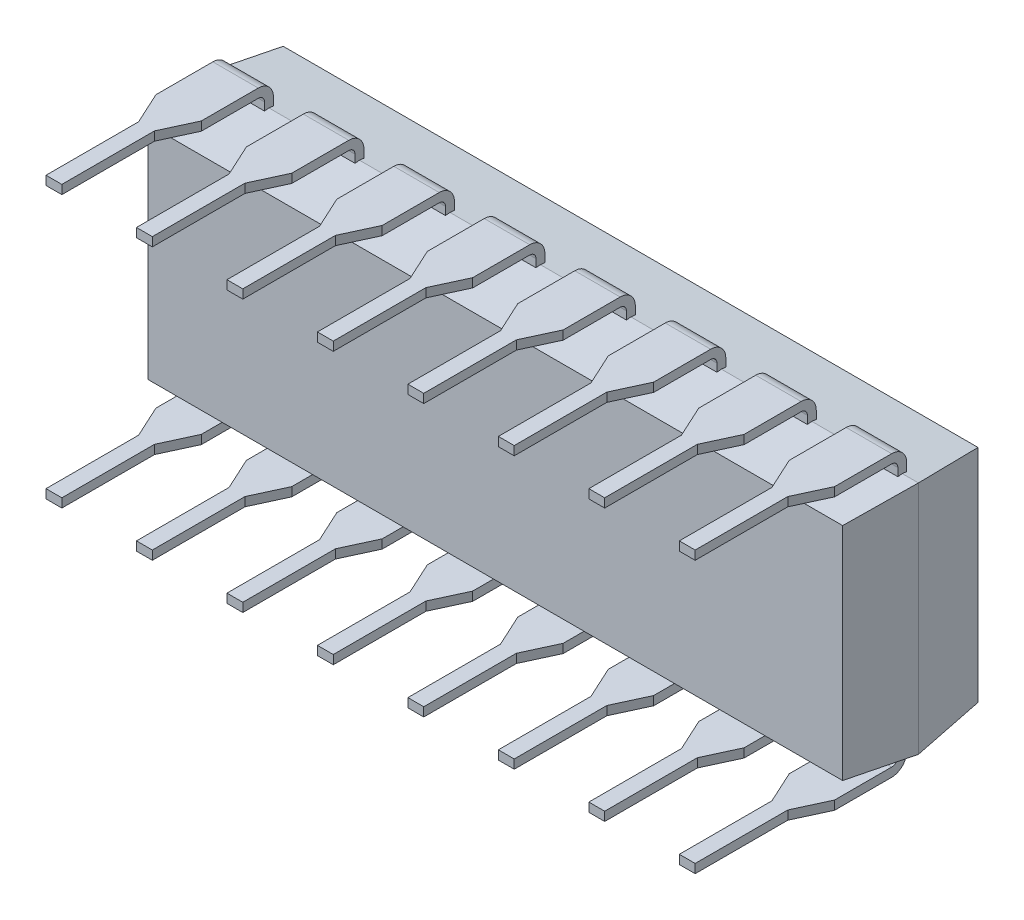
from build123d import *

# Parameters (mm, degrees)
RESSALTO_EXTRUS_O1_DEPTH        = 9.98
CORTE_EXTRUS_O2_DEPTH           = 3.55
ESBO_O8_R                       = 1
CORTE_EXTRUS_O5_DEPTH           = 0.5
ESBO_O6_W                       = 1.275
ESBO_O6_H                       = 0.25
RESSALTO_EXTRUS_O2_DEPTH        = 0.025
ESBO_O7_W                       = 1.275
ESBO_O7_H                       = 0.25
CORTE_EXTRUS_O6_START           = -0.25
CORTE_EXTRUS_O6_DEPTH           = 0.25
ESBO_O10_W                      = 0.445
ESBO_O10_H                      = 0.25
RESSALTO_EXTRUS_O3_DEPTH        = 2.6
PADR_O_LINEAR1_COUNT            = 8
PADR_O_LINEAR1_PITCH            = 2.54
PADR_O_LINEAR1_COPY_1_SKETCH_W  = 1.275
PADR_O_LINEAR1_COPY_1_SKETCH_H  = 0.25
PADR_O_LINEAR1_COPY_1_DEPTH     = 0.025
PADR_O_LINEAR1_COPY_2_SKETCH_W  = 1.275
PADR_O_LINEAR1_COPY_2_SKETCH_H  = 0.25
PADR_O_LINEAR1_COPY_2_DEPTH     = 0.025
PADR_O_LINEAR1_COPY_3_SKETCH_W  = 1.275
PADR_O_LINEAR1_COPY_3_SKETCH_H  = 0.25
PADR_O_LINEAR1_COPY_3_DEPTH     = 0.025
PADR_O_LINEAR1_COPY_4_SKETCH_W  = 1.275
PADR_O_LINEAR1_COPY_4_SKETCH_H  = 0.25
PADR_O_LINEAR1_COPY_4_DEPTH     = 0.025
PADR_O_LINEAR1_COPY_5_SKETCH_W  = 1.275
PADR_O_LINEAR1_COPY_5_SKETCH_H  = 0.25
PADR_O_LINEAR1_COPY_5_DEPTH     = 0.025
PADR_O_LINEAR1_COPY_6_SKETCH_W  = 1.275
PADR_O_LINEAR1_COPY_6_SKETCH_H  = 0.25
PADR_O_LINEAR1_COPY_6_DEPTH     = 0.025
PADR_O_LINEAR1_COPY_7_SKETCH_W  = 1.275
PADR_O_LINEAR1_COPY_7_SKETCH_H  = 0.25
PADR_O_LINEAR1_COPY_7_DEPTH     = 0.025
PADR_O_LINEAR1_COPY_8_SKETCH_W  = 1.275
PADR_O_LINEAR1_COPY_8_SKETCH_H  = 0.25
PADR_O_LINEAR1_COPY_9_SKETCH_W  = 1.275
PADR_O_LINEAR1_COPY_9_SKETCH_H  = 0.25
PADR_O_LINEAR1_COPY_10_SKETCH_W = 1.275
PADR_O_LINEAR1_COPY_10_SKETCH_H = 0.25
PADR_O_LINEAR1_COPY_11_SKETCH_W = 1.275
PADR_O_LINEAR1_COPY_11_SKETCH_H = 0.25
PADR_O_LINEAR1_COPY_12_SKETCH_W = 1.275
PADR_O_LINEAR1_COPY_12_SKETCH_H = 0.25
PADR_O_LINEAR1_COPY_13_SKETCH_W = 1.275
PADR_O_LINEAR1_COPY_13_SKETCH_H = 0.25
PADR_O_LINEAR1_COPY_14_SKETCH_W = 1.275
PADR_O_LINEAR1_COPY_14_SKETCH_H = 0.25
PADR_O_START                    = -0.25
PADR_O_LINEAR1_COPY_15_DEPTH    = 0.25
PADR_O_LINEAR1_COPY_16_DEPTH    = 0.25
PADR_O_LINEAR1_COPY_17_DEPTH    = 0.25
PADR_O_LINEAR1_COPY_18_DEPTH    = 0.25
PADR_O_LINEAR1_COPY_19_DEPTH    = 0.25
PADR_O_LINEAR1_COPY_20_DEPTH    = 0.25
PADR_O_LINEAR1_COPY_21_DEPTH    = 0.25
PADR_O_LINEAR1_COPY_22_SKETCH_W = 0.445
PADR_O_LINEAR1_COPY_22_SKETCH_H = 0.25
PADR_O_LINEAR1_COPY_22_DEPTH    = 2.6
PADR_O_LINEAR1_COPY_23_SKETCH_W = 0.445
PADR_O_LINEAR1_COPY_23_SKETCH_H = 0.25
PADR_O_LINEAR1_COPY_23_DEPTH    = 2.6
PADR_O_LINEAR1_COPY_24_SKETCH_W = 0.445
PADR_O_LINEAR1_COPY_24_SKETCH_H = 0.25
PADR_O_LINEAR1_COPY_24_DEPTH    = 2.6
PADR_O_LINEAR1_COPY_25_SKETCH_W = 0.445
PADR_O_LINEAR1_COPY_25_SKETCH_H = 0.25
PADR_O_LINEAR1_COPY_25_DEPTH    = 2.6
PADR_O_LINEAR1_COPY_26_SKETCH_W = 0.445
PADR_O_LINEAR1_COPY_26_SKETCH_H = 0.25
PADR_O_LINEAR1_COPY_26_DEPTH    = 2.6
PADR_O_LINEAR1_COPY_27_SKETCH_W = 0.445
PADR_O_LINEAR1_COPY_27_SKETCH_H = 0.25
PADR_O_LINEAR1_COPY_27_DEPTH    = 2.6
PADR_O_LINEAR1_COPY_28_SKETCH_W = 0.445
PADR_O_LINEAR1_COPY_28_SKETCH_H = 0.25
PADR_O_LINEAR1_COPY_28_DEPTH    = 2.6


with BuildPart() as part:
    # Esboço1 → Ressalto-extrusão1 (new, symmetric)
    with BuildSketch(Plane(origin=(0, 0, 0), x_dir=(0, 0, -1), z_dir=(1, 0, 0))):
        Polygon((0.9, 3.1), (0.9, -3.1), (2.8, -3.3), (4.7, -3.1), (4.7, 3.1), (2.8, 3.3), align=None)
    extrude(amount=RESSALTO_EXTRUS_O1_DEPTH, both=True)

    # Esboço3 → Corte-extrusão2 (cut, symmetric)
    with BuildSketch(Plane(origin=(0, 0, 0), x_dir=(1, 0, 0), z_dir=(0, 1, 0))):
        Polygon((-9.98, 2.8), (-9.749897634, 4.726835982), (-10.916348907, 4.726835982), (-10.916348907, 0.873164018), (-9.749897634, 0.873164018), align=None)
    corte_extrus_o2 = extrude(amount=CORTE_EXTRUS_O2_DEPTH, both=True, mode=Mode.SUBTRACT)

    # Espelhar1: Corte-extrusão2 across plane
    add(corte_extrus_o2.mirror(Plane(origin=(0, 0, 0), x_dir=(0, 0, 1), z_dir=(1, 0, 0))), mode=Mode.SUBTRACT)

    # Esboço8 → Corte-extrusão5 (cut)
    with BuildSketch(Plane(origin=(0, 0, -4.7), x_dir=(-1, 0, 0), z_dir=(0, 0, -1))):
        with Locations((9.753102382, 0)):
            Circle(ESBO_O8_R)
    extrude(amount=-CORTE_EXTRUS_O5_DEPTH, mode=Mode.SUBTRACT)

    # Esboço6 → Ressalto-extrusão2 (add, symmetric)
    with BuildSketch(Plane(origin=(0, 3.3, 0), x_dir=(1, 0, 0), z_dir=(0, 1, 0))):
        with Locations((-8.89, 2.8)):
            Rectangle(ESBO_O6_W, ESBO_O6_H)
    ressalto_extrus_o2 = extrude(amount=RESSALTO_EXTRUS_O2_DEPTH, both=True)

    # Varredura1: sweep along a curve in space
    with BuildLine() as varredura1_path:
        Line((-8.89, 3.325, -2.8), (-8.89, 3.51, -2.8))
        ThreePointArc((-8.89, 3.51, -2.8), (-8.89, 3.722132034, -2.712132034), (-8.89, 3.81, -2.5))
        Line((-8.89, 3.81, -2.5), (-8.89, 3.81, 0))
    # Esboço7 → Varredura1 (sweep)
    with BuildSketch(Plane(origin=(0, 3.325, 0), x_dir=(1, 0, 0), z_dir=(0, 1, 0))):
        with Locations((-8.89, 2.8)):
            Rectangle(ESBO_O7_W, ESBO_O7_H)
    varredura1 = sweep(path=varredura1_path.line)

    # Esboço9 → Corte-extrusão6 (cut)
    with BuildSketch(Plane(origin=(0, 3.935, 0), x_dir=(1, 0, 0), z_dir=(0, 1, 0)).offset(CORTE_EXTRUS_O6_START)):
        Polygon((-9.1125, 0), (-9.5275, 0.9), (-9.5275, -0.2), (-8.2525, -0.2), (-8.2525, 0.9), (-8.6675, 0), align=None)
    corte_extrus_o6 = extrude(amount=CORTE_EXTRUS_O6_DEPTH, mode=Mode.SUBTRACT)

    # Esboço10 → Ressalto-extrusão3 (add)
    with BuildSketch(Plane.XY):
        with Locations((-8.89, 3.81)):
            Rectangle(ESBO_O10_W, ESBO_O10_H)
    ressalto_extrus_o3 = extrude(amount=RESSALTO_EXTRUS_O3_DEPTH)

    # Espelhar2: Ressalto-extrusão2, Varredura1, Corte-extrusão6, Ressalto-extrusão3 across plane
    add(ressalto_extrus_o2.mirror(Plane.ZX))
    add(varredura1.mirror(Plane.ZX))
    add(corte_extrus_o6.mirror(Plane.ZX), mode=Mode.SUBTRACT)
    add(ressalto_extrus_o3.mirror(Plane.ZX))

    # Padrão linear1: Ressalto-extrusão2, Varredura1, Corte-extrusão6, Ressalto-extrusão3 ×8
    with Locations(*[(i * PADR_O_LINEAR1_PITCH, 0, 0) for i in range(1, PADR_O_LINEAR1_COUNT)]):
        add(ressalto_extrus_o2)
        add(varredura1)
        add(corte_extrus_o6, mode=Mode.SUBTRACT)
        add(ressalto_extrus_o3)

    # Padrão linear1 copy 1 sketch → Padrão linear1 copy 1 (add, symmetric)
    with BuildSketch(Plane(origin=(2.54, -3.3, 0), x_dir=(1, 0, 0), z_dir=(0, -1, 0))):
        with Locations((-8.89, -2.8)):
            Rectangle(PADR_O_LINEAR1_COPY_1_SKETCH_W, PADR_O_LINEAR1_COPY_1_SKETCH_H)
    extrude(amount=PADR_O_LINEAR1_COPY_1_DEPTH, both=True)

    # Padrão linear1 copy 2 sketch → Padrão linear1 copy 2 (add, symmetric)
    with BuildSketch(Plane(origin=(5.08, -3.3, 0), x_dir=(1, 0, 0), z_dir=(0, -1, 0))):
        with Locations((-8.89, -2.8)):
            Rectangle(PADR_O_LINEAR1_COPY_2_SKETCH_W, PADR_O_LINEAR1_COPY_2_SKETCH_H)
    extrude(amount=PADR_O_LINEAR1_COPY_2_DEPTH, both=True)

    # Padrão linear1 copy 3 sketch → Padrão linear1 copy 3 (add, symmetric)
    with BuildSketch(Plane(origin=(7.62, -3.3, 0), x_dir=(1, 0, 0), z_dir=(0, -1, 0))):
        with Locations((-8.89, -2.8)):
            Rectangle(PADR_O_LINEAR1_COPY_3_SKETCH_W, PADR_O_LINEAR1_COPY_3_SKETCH_H)
    extrude(amount=PADR_O_LINEAR1_COPY_3_DEPTH, both=True)

    # Padrão linear1 copy 4 sketch → Padrão linear1 copy 4 (add, symmetric)
    with BuildSketch(Plane(origin=(10.16, -3.3, 0), x_dir=(1, 0, 0), z_dir=(0, -1, 0))):
        with Locations((-8.89, -2.8)):
            Rectangle(PADR_O_LINEAR1_COPY_4_SKETCH_W, PADR_O_LINEAR1_COPY_4_SKETCH_H)
    extrude(amount=PADR_O_LINEAR1_COPY_4_DEPTH, both=True)

    # Padrão linear1 copy 5 sketch → Padrão linear1 copy 5 (add, symmetric)
    with BuildSketch(Plane(origin=(12.7, -3.3, 0), x_dir=(1, 0, 0), z_dir=(0, -1, 0))):
        with Locations((-8.89, -2.8)):
            Rectangle(PADR_O_LINEAR1_COPY_5_SKETCH_W, PADR_O_LINEAR1_COPY_5_SKETCH_H)
    extrude(amount=PADR_O_LINEAR1_COPY_5_DEPTH, both=True)

    # Padrão linear1 copy 6 sketch → Padrão linear1 copy 6 (add, symmetric)
    with BuildSketch(Plane(origin=(15.24, -3.3, 0), x_dir=(1, 0, 0), z_dir=(0, -1, 0))):
        with Locations((-8.89, -2.8)):
            Rectangle(PADR_O_LINEAR1_COPY_6_SKETCH_W, PADR_O_LINEAR1_COPY_6_SKETCH_H)
    extrude(amount=PADR_O_LINEAR1_COPY_6_DEPTH, both=True)

    # Padrão linear1 copy 7 sketch → Padrão linear1 copy 7 (add, symmetric)
    with BuildSketch(Plane(origin=(17.78, -3.3, 0), x_dir=(1, 0, 0), z_dir=(0, -1, 0))):
        with Locations((-8.89, -2.8)):
            Rectangle(PADR_O_LINEAR1_COPY_7_SKETCH_W, PADR_O_LINEAR1_COPY_7_SKETCH_H)
    extrude(amount=PADR_O_LINEAR1_COPY_7_DEPTH, both=True)

    # Padrão linear1 copy 8: sweep along a curve in space
    with BuildLine() as padr_o_linear1_copy_8_path:
        Line((-6.35, -3.325, -2.8), (-6.35, -3.51, -2.8))
        ThreePointArc((-6.35, -3.51, -2.8), (-6.35, -3.722132034, -2.712132034), (-6.35, -3.81, -2.5))
        Line((-6.35, -3.81, -2.5), (-6.35, -3.81, 0))
    # Padrão linear1 copy 8 sketch → Padrão linear1 copy 8 (sweep)
    with BuildSketch(Plane(origin=(2.54, -3.325, 0), x_dir=(1, 0, 0), z_dir=(0, -1, 0))):
        with Locations((-8.89, -2.8)):
            Rectangle(PADR_O_LINEAR1_COPY_8_SKETCH_W, PADR_O_LINEAR1_COPY_8_SKETCH_H)
    sweep(path=padr_o_linear1_copy_8_path.line)

    # Padrão linear1 copy 9: sweep along a curve in space
    with BuildLine() as padr_o_linear1_copy_9_path:
        Line((-3.81, -3.325, -2.8), (-3.81, -3.51, -2.8))
        ThreePointArc((-3.81, -3.51, -2.8), (-3.81, -3.722132034, -2.712132034), (-3.81, -3.81, -2.5))
        Line((-3.81, -3.81, -2.5), (-3.81, -3.81, 0))
    # Padrão linear1 copy 9 sketch → Padrão linear1 copy 9 (sweep)
    with BuildSketch(Plane(origin=(5.08, -3.325, 0), x_dir=(1, 0, 0), z_dir=(0, -1, 0))):
        with Locations((-8.89, -2.8)):
            Rectangle(PADR_O_LINEAR1_COPY_9_SKETCH_W, PADR_O_LINEAR1_COPY_9_SKETCH_H)
    sweep(path=padr_o_linear1_copy_9_path.line)

    # Padrão linear1 copy 10: sweep along a curve in space
    with BuildLine() as padr_o_linear1_copy_10_path:
        Line((-1.27, -3.325, -2.8), (-1.27, -3.51, -2.8))
        ThreePointArc((-1.27, -3.51, -2.8), (-1.27, -3.722132034, -2.712132034), (-1.27, -3.81, -2.5))
        Line((-1.27, -3.81, -2.5), (-1.27, -3.81, 0))
    # Padrão linear1 copy 10 sketch → Padrão linear1 copy 10 (sweep)
    with BuildSketch(Plane(origin=(7.62, -3.325, 0), x_dir=(1, 0, 0), z_dir=(0, -1, 0))):
        with Locations((-8.89, -2.8)):
            Rectangle(PADR_O_LINEAR1_COPY_10_SKETCH_W, PADR_O_LINEAR1_COPY_10_SKETCH_H)
    sweep(path=padr_o_linear1_copy_10_path.line)

    # Padrão linear1 copy 11: sweep along a curve in space
    with BuildLine() as padr_o_linear1_copy_11_path:
        Line((1.27, -3.325, -2.8), (1.27, -3.51, -2.8))
        ThreePointArc((1.27, -3.51, -2.8), (1.27, -3.722132034, -2.712132034), (1.27, -3.81, -2.5))
        Line((1.27, -3.81, -2.5), (1.27, -3.81, 0))
    # Padrão linear1 copy 11 sketch → Padrão linear1 copy 11 (sweep)
    with BuildSketch(Plane(origin=(10.16, -3.325, 0), x_dir=(1, 0, 0), z_dir=(0, -1, 0))):
        with Locations((-8.89, -2.8)):
            Rectangle(PADR_O_LINEAR1_COPY_11_SKETCH_W, PADR_O_LINEAR1_COPY_11_SKETCH_H)
    sweep(path=padr_o_linear1_copy_11_path.line)

    # Padrão linear1 copy 12: sweep along a curve in space
    with BuildLine() as padr_o_linear1_copy_12_path:
        Line((3.81, -3.325, -2.8), (3.81, -3.51, -2.8))
        ThreePointArc((3.81, -3.51, -2.8), (3.81, -3.722132034, -2.712132034), (3.81, -3.81, -2.5))
        Line((3.81, -3.81, -2.5), (3.81, -3.81, 0))
    # Padrão linear1 copy 12 sketch → Padrão linear1 copy 12 (sweep)
    with BuildSketch(Plane(origin=(12.7, -3.325, 0), x_dir=(1, 0, 0), z_dir=(0, -1, 0))):
        with Locations((-8.89, -2.8)):
            Rectangle(PADR_O_LINEAR1_COPY_12_SKETCH_W, PADR_O_LINEAR1_COPY_12_SKETCH_H)
    sweep(path=padr_o_linear1_copy_12_path.line)

    # Padrão linear1 copy 13: sweep along a curve in space
    with BuildLine() as padr_o_linear1_copy_13_path:
        Line((6.35, -3.325, -2.8), (6.35, -3.51, -2.8))
        ThreePointArc((6.35, -3.51, -2.8), (6.35, -3.722132034, -2.712132034), (6.35, -3.81, -2.5))
        Line((6.35, -3.81, -2.5), (6.35, -3.81, 0))
    # Padrão linear1 copy 13 sketch → Padrão linear1 copy 13 (sweep)
    with BuildSketch(Plane(origin=(15.24, -3.325, 0), x_dir=(1, 0, 0), z_dir=(0, -1, 0))):
        with Locations((-8.89, -2.8)):
            Rectangle(PADR_O_LINEAR1_COPY_13_SKETCH_W, PADR_O_LINEAR1_COPY_13_SKETCH_H)
    sweep(path=padr_o_linear1_copy_13_path.line)

    # Padrão linear1 copy 14: sweep along a curve in space
    with BuildLine() as padr_o_linear1_copy_14_path:
        Line((8.89, -3.325, -2.8), (8.89, -3.51, -2.8))
        ThreePointArc((8.89, -3.51, -2.8), (8.89, -3.722132034, -2.712132034), (8.89, -3.81, -2.5))
        Line((8.89, -3.81, -2.5), (8.89, -3.81, 0))
    # Padrão linear1 copy 14 sketch → Padrão linear1 copy 14 (sweep)
    with BuildSketch(Plane(origin=(17.78, -3.325, 0), x_dir=(1, 0, 0), z_dir=(0, -1, 0))):
        with Locations((-8.89, -2.8)):
            Rectangle(PADR_O_LINEAR1_COPY_14_SKETCH_W, PADR_O_LINEAR1_COPY_14_SKETCH_H)
    sweep(path=padr_o_linear1_copy_14_path.line)

    # Padrão linear1 copy 15 sketch → Padrão linear1 copy 15 (cut)
    with BuildSketch(Plane(origin=(2.54, -3.935, 0), x_dir=(1, 0, 0), z_dir=(0, -1, 0)).offset(PADR_O_START)):
        Polygon((-9.1125, 0), (-9.5275, -0.9), (-9.5275, 0.2), (-8.2525, 0.2), (-8.2525, -0.9), (-8.6675, 0), align=None)
    extrude(amount=PADR_O_LINEAR1_COPY_15_DEPTH, mode=Mode.SUBTRACT)

    # Padrão linear1 copy 16 sketch → Padrão linear1 copy 16 (cut)
    with BuildSketch(Plane(origin=(5.08, -3.935, 0), x_dir=(1, 0, 0), z_dir=(0, -1, 0)).offset(PADR_O_START)):
        Polygon((-9.1125, 0), (-9.5275, -0.9), (-9.5275, 0.2), (-8.2525, 0.2), (-8.2525, -0.9), (-8.6675, 0), align=None)
    extrude(amount=PADR_O_LINEAR1_COPY_16_DEPTH, mode=Mode.SUBTRACT)

    # Padrão linear1 copy 17 sketch → Padrão linear1 copy 17 (cut)
    with BuildSketch(Plane(origin=(7.62, -3.935, 0), x_dir=(1, 0, 0), z_dir=(0, -1, 0)).offset(PADR_O_START)):
        Polygon((-9.1125, 0), (-9.5275, -0.9), (-9.5275, 0.2), (-8.2525, 0.2), (-8.2525, -0.9), (-8.6675, 0), align=None)
    extrude(amount=PADR_O_LINEAR1_COPY_17_DEPTH, mode=Mode.SUBTRACT)

    # Padrão linear1 copy 18 sketch → Padrão linear1 copy 18 (cut)
    with BuildSketch(Plane(origin=(10.16, -3.935, 0), x_dir=(1, 0, 0), z_dir=(0, -1, 0)).offset(PADR_O_START)):
        Polygon((-9.1125, 0), (-9.5275, -0.9), (-9.5275, 0.2), (-8.2525, 0.2), (-8.2525, -0.9), (-8.6675, 0), align=None)
    extrude(amount=PADR_O_LINEAR1_COPY_18_DEPTH, mode=Mode.SUBTRACT)

    # Padrão linear1 copy 19 sketch → Padrão linear1 copy 19 (cut)
    with BuildSketch(Plane(origin=(12.7, -3.935, 0), x_dir=(1, 0, 0), z_dir=(0, -1, 0)).offset(PADR_O_START)):
        Polygon((-9.1125, 0), (-9.5275, -0.9), (-9.5275, 0.2), (-8.2525, 0.2), (-8.2525, -0.9), (-8.6675, 0), align=None)
    extrude(amount=PADR_O_LINEAR1_COPY_19_DEPTH, mode=Mode.SUBTRACT)

    # Padrão linear1 copy 20 sketch → Padrão linear1 copy 20 (cut)
    with BuildSketch(Plane(origin=(15.24, -3.935, 0), x_dir=(1, 0, 0), z_dir=(0, -1, 0)).offset(PADR_O_START)):
        Polygon((-9.1125, 0), (-9.5275, -0.9), (-9.5275, 0.2), (-8.2525, 0.2), (-8.2525, -0.9), (-8.6675, 0), align=None)
    extrude(amount=PADR_O_LINEAR1_COPY_20_DEPTH, mode=Mode.SUBTRACT)

    # Padrão linear1 copy 21 sketch → Padrão linear1 copy 21 (cut)
    with BuildSketch(Plane(origin=(17.78, -3.935, 0), x_dir=(1, 0, 0), z_dir=(0, -1, 0)).offset(PADR_O_START)):
        Polygon((-9.1125, 0), (-9.5275, -0.9), (-9.5275, 0.2), (-8.2525, 0.2), (-8.2525, -0.9), (-8.6675, 0), align=None)
    extrude(amount=PADR_O_LINEAR1_COPY_21_DEPTH, mode=Mode.SUBTRACT)

    # Padrão linear1 copy 22 sketch → Padrão linear1 copy 22 (add)
    with BuildSketch(Plane(origin=(2.54, 0, 0), x_dir=(1, 0, 0), z_dir=(0, 0, 1))):
        with Locations((-8.89, -3.81)):
            Rectangle(PADR_O_LINEAR1_COPY_22_SKETCH_W, PADR_O_LINEAR1_COPY_22_SKETCH_H)
    extrude(amount=PADR_O_LINEAR1_COPY_22_DEPTH)

    # Padrão linear1 copy 23 sketch → Padrão linear1 copy 23 (add)
    with BuildSketch(Plane(origin=(5.08, 0, 0), x_dir=(1, 0, 0), z_dir=(0, 0, 1))):
        with Locations((-8.89, -3.81)):
            Rectangle(PADR_O_LINEAR1_COPY_23_SKETCH_W, PADR_O_LINEAR1_COPY_23_SKETCH_H)
    extrude(amount=PADR_O_LINEAR1_COPY_23_DEPTH)

    # Padrão linear1 copy 24 sketch → Padrão linear1 copy 24 (add)
    with BuildSketch(Plane(origin=(7.62, 0, 0), x_dir=(1, 0, 0), z_dir=(0, 0, 1))):
        with Locations((-8.89, -3.81)):
            Rectangle(PADR_O_LINEAR1_COPY_24_SKETCH_W, PADR_O_LINEAR1_COPY_24_SKETCH_H)
    extrude(amount=PADR_O_LINEAR1_COPY_24_DEPTH)

    # Padrão linear1 copy 25 sketch → Padrão linear1 copy 25 (add)
    with BuildSketch(Plane(origin=(10.16, 0, 0), x_dir=(1, 0, 0), z_dir=(0, 0, 1))):
        with Locations((-8.89, -3.81)):
            Rectangle(PADR_O_LINEAR1_COPY_25_SKETCH_W, PADR_O_LINEAR1_COPY_25_SKETCH_H)
    extrude(amount=PADR_O_LINEAR1_COPY_25_DEPTH)

    # Padrão linear1 copy 26 sketch → Padrão linear1 copy 26 (add)
    with BuildSketch(Plane(origin=(12.7, 0, 0), x_dir=(1, 0, 0), z_dir=(0, 0, 1))):
        with Locations((-8.89, -3.81)):
            Rectangle(PADR_O_LINEAR1_COPY_26_SKETCH_W, PADR_O_LINEAR1_COPY_26_SKETCH_H)
    extrude(amount=PADR_O_LINEAR1_COPY_26_DEPTH)

    # Padrão linear1 copy 27 sketch → Padrão linear1 copy 27 (add)
    with BuildSketch(Plane(origin=(15.24, 0, 0), x_dir=(1, 0, 0), z_dir=(0, 0, 1))):
        with Locations((-8.89, -3.81)):
            Rectangle(PADR_O_LINEAR1_COPY_27_SKETCH_W, PADR_O_LINEAR1_COPY_27_SKETCH_H)
    extrude(amount=PADR_O_LINEAR1_COPY_27_DEPTH)

    # Padrão linear1 copy 28 sketch → Padrão linear1 copy 28 (add)
    with BuildSketch(Plane(origin=(17.78, 0, 0), x_dir=(1, 0, 0), z_dir=(0, 0, 1))):
        with Locations((-8.89, -3.81)):
            Rectangle(PADR_O_LINEAR1_COPY_28_SKETCH_W, PADR_O_LINEAR1_COPY_28_SKETCH_H)
    extrude(amount=PADR_O_LINEAR1_COPY_28_DEPTH)


solid = part.part
